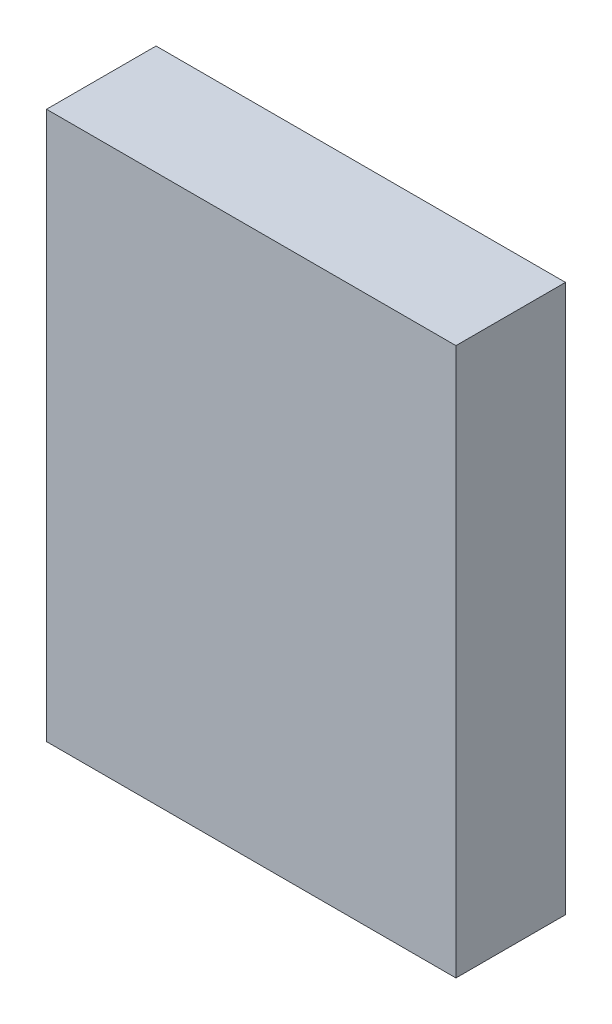
from build123d import *

# Parameters (mm, degrees)
SKETCH_5_W      = 37.377926944
SKETCH_5_H      = 50
EXTRUDE_2_DEPTH = 10


with BuildPart() as part:
    # Эскиз5 → Бобышка-Вытянуть2 (new body)
    with BuildSketch(Plane.XY):
        Rectangle(SKETCH_5_W, SKETCH_5_H)
    extrude(amount=EXTRUDE_2_DEPTH)


solid = part.part
